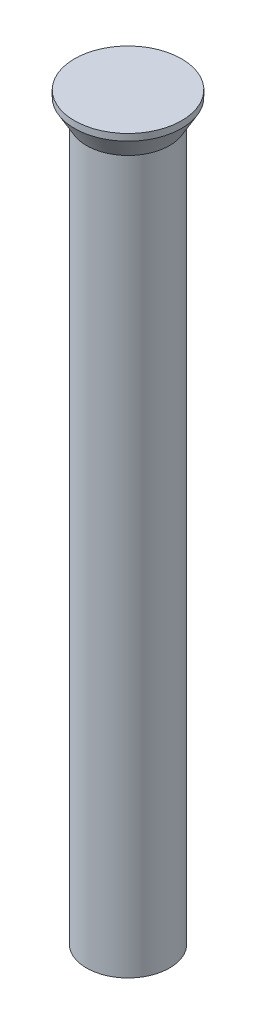
from build123d import *


with BuildPart() as part:
    # Sketch1 → Revolve1 (revolve)
    with BuildSketch(Plane.XY, mode=Mode.PRIVATE) as revolve1_sk:
        Polygon((0, 0), (4, 0), (4, -0.5), (3.1, -2.058845727), (3.1, -55.2), (0, -55.2), align=None)
    revolve(revolve1_sk.sketch.rotate(Axis((0, -60.2, 0), (0, 1, 0)), 90), axis=Axis((0, -60.2, 0), (0, 1, 0)))


solid = part.part
